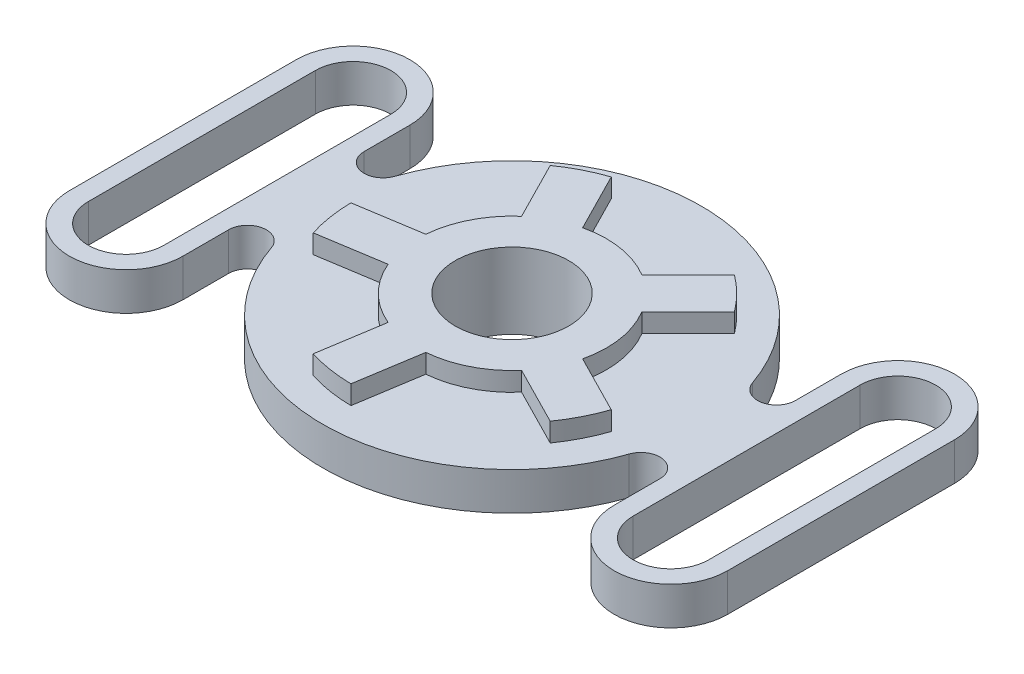
from build123d import *

# Parameters (mm, degrees)
SKETCH1_R           = 15
BOSS_EXTRUDE1_DEPTH = 10
BOSS_EXTRUDE2_DEPTH = 5


with BuildPart() as part:
    # Sketch1 → Boss-Extrude1 (new, symmetric)
    with BuildSketch(Plane(origin=(0, 0, 0), x_dir=(1, 0, 0), z_dir=(0, 1, 0))):
        with BuildLine():
            Line((25.151236226, 33.636517601), (12.918361615, 21.403642989))
            ThreePointArc((12.918361615, 21.403642989), (3.910861626, 24.692208515), (-5.672002568, 24.348067415))
            Line((-5.672002568, 24.348067415), (-13.525991536, 39.762388673))
            ThreePointArc((-13.525991536, 39.762388673), (-19.067600989, 37.422274016), (-24.218069826, 34.314502676))
            Line((-24.218069826, 34.314502676), (-16.364080859, 18.900181419))
            ThreePointArc((-16.364080859, 18.900181419), (-22.275163105, 11.349762493), (-24.90913336, 2.129571608))
            Line((-24.90913336, 2.129571608), (-41.996040101, -0.576728553))
            ThreePointArc((-41.996040101, -0.576728553), (-41.482910305, -6.570247532), (-40.118826521, -12.42898864))
            Line((-40.118826521, -12.42898864), (-23.03191978, -9.722688479))
            ThreePointArc((-23.03191978, -9.722688479), (-17.67766953, -17.67766953), (-9.722688479, -23.03191978))
            Line((-9.722688479, -23.03191978), (-12.42898864, -40.118826521))
            ThreePointArc((-12.42898864, -40.118826521), (-6.570247532, -41.482910305), (-0.576728553, -41.996040101))
            Line((-0.576728553, -41.996040101), (2.129571608, -24.90913336))
            ThreePointArc((2.129571608, -24.90913336), (11.349762493, -22.275163105), (18.900181419, -16.364080859))
            Line((18.900181419, -16.364080859), (34.314502676, -24.218069826))
            ThreePointArc((34.314502676, -24.218069826), (37.422274016, -19.067600989), (39.762388673, -13.525991536))
            Line((39.762388673, -13.525991536), (24.348067415, -5.672002568))
            ThreePointArc((24.348067415, -5.672002568), (24.692208515, 3.910861626), (21.403642989, 12.918361615))
            Line((21.403642989, 12.918361615), (33.636517601, 25.151236226))
            ThreePointArc((33.636517601, 25.151236226), (29.69848481, 29.69848481), (25.151236226, 33.636517601))
        make_face()
        Circle(SKETCH1_R, mode=Mode.SUBTRACT)
    extrude(amount=BOSS_EXTRUDE1_DEPTH, both=True)

    # Sketch1<3> → Boss-Extrude2 (add, symmetric)
    with BuildSketch(Plane(origin=(0, 0, 0), x_dir=(1, 0, 0), z_dir=(0, 1, 0))):
        with BuildLine():
            Line((57, -17.916472867), (57, -30))
            ThreePointArc((57, -30), (72, -45), (87, -30))
            Line((87, -30), (87, 30))
            ThreePointArc((87, 30), (72, 45), (57, 30))
            Line((57, 30), (57, 17.916472867))
            ThreePointArc((57, 17.916472867), (52.825722824, 12.985126011), (47.272727273, 16.287702607))
            ThreePointArc((47.272727273, 16.287702607), (0, 50), (-47.272727273, 16.287702607))
            ThreePointArc((-47.272727273, 16.287702607), (-52.825722824, 12.985126011), (-57, 17.916472867))
            Line((-57, 17.916472867), (-57, 30))
            ThreePointArc((-57, 30), (-72, 45), (-87, 30))
            Line((-87, 30), (-87, -30))
            ThreePointArc((-87, -30), (-72, -45), (-57, -30))
            Line((-57, -30), (-57, -17.916472867))
            ThreePointArc((-57, -17.916472867), (-52.825722824, -12.985126011), (-47.272727273, -16.287702607))
            ThreePointArc((-47.272727273, -16.287702607), (0, -50), (47.272727273, -16.287702607))
            ThreePointArc((47.272727273, -16.287702607), (52.825722824, -12.985126011), (57, -17.916472867))
        make_face()
        with BuildLine():
            Line((-82, -30), (-82, 30))
            ThreePointArc((-82, 30), (-72, 40), (-62, 30))
            Line((-62, 30), (-62, -30))
            ThreePointArc((-62, -30), (-72, -40), (-82, -30))
        make_face(mode=Mode.SUBTRACT)
        with BuildLine():
            Line((33.636517601, 25.151236226), (21.403642989, 12.918361615))
            ThreePointArc((21.403642989, 12.918361615), (24.084134557, 6.704808919), (25, 0))
            ThreePointArc((25, 0), (24.836482092, -2.85467289), (24.348067415, -5.672002568))
            Line((24.348067415, -5.672002568), (39.762388673, -13.525991536))
            ThreePointArc((39.762388673, -13.525991536), (37.422274016, -19.067600989), (34.314502676, -24.218069826))
            Line((34.314502676, -24.218069826), (18.900181419, -16.364080859))
            ThreePointArc((18.900181419, -16.364080859), (11.349762493, -22.275163105), (2.129571608, -24.90913336))
            Line((2.129571608, -24.90913336), (-0.576728553, -41.996040101))
            ThreePointArc((-0.576728553, -41.996040101), (-6.570247532, -41.482910305), (-12.42898864, -40.118826521))
            Line((-12.42898864, -40.118826521), (-9.722688479, -23.03191978))
            ThreePointArc((-9.722688479, -23.03191978), (-17.67766953, -17.67766953), (-23.03191978, -9.722688479))
            Line((-23.03191978, -9.722688479), (-40.118826521, -12.42898864))
            ThreePointArc((-40.118826521, -12.42898864), (-41.482910305, -6.570247532), (-41.996040101, -0.576728553))
            Line((-41.996040101, -0.576728553), (-24.90913336, 2.129571608))
            ThreePointArc((-24.90913336, 2.129571608), (-22.275163105, 11.349762493), (-16.364080859, 18.900181419))
            Line((-16.364080859, 18.900181419), (-24.218069826, 34.314502676))
            ThreePointArc((-24.218069826, 34.314502676), (-19.067600989, 37.422274016), (-13.525991536, 39.762388673))
            Line((-13.525991536, 39.762388673), (-5.672002568, 24.348067415))
            ThreePointArc((-5.672002568, 24.348067415), (3.910861626, 24.692208515), (12.918361615, 21.403642989))
            Line((12.918361615, 21.403642989), (25.151236226, 33.636517601))
            ThreePointArc((25.151236226, 33.636517601), (29.69848481, 29.69848481), (33.636517601, 25.151236226))
        make_face(mode=Mode.SUBTRACT)
        with BuildLine():
            ThreePointArc((62, 30), (72, 40), (82, 30))
            Line((82, 30), (82, -30))
            ThreePointArc((82, -30), (72, -40), (62, -30))
            Line((62, -30), (62, 30))
        make_face(mode=Mode.SUBTRACT)
    extrude(amount=BOSS_EXTRUDE2_DEPTH, both=True)


solid = part.part
